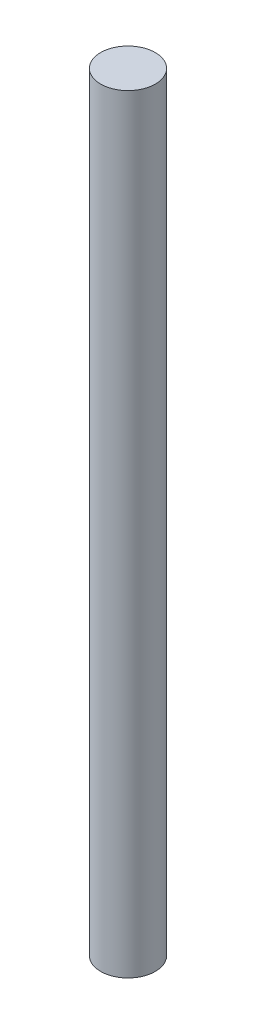
from build123d import *

# Parameters (mm, degrees)
SKETCH1_R           = 4
BOSS_EXTRUDE1_DEPTH = 112.5


with BuildPart() as part:
    # Sketch1 → Boss-Extrude1 (new body)
    with BuildSketch(Plane(origin=(0, 0, 0), x_dir=(1, 0, 0), z_dir=(0, 1, 0))):
        with Locations(Location((0, 0, 0), (0, 0, 270))):
            Circle(SKETCH1_R)
    extrude(amount=BOSS_EXTRUDE1_DEPTH)


solid = part.part
